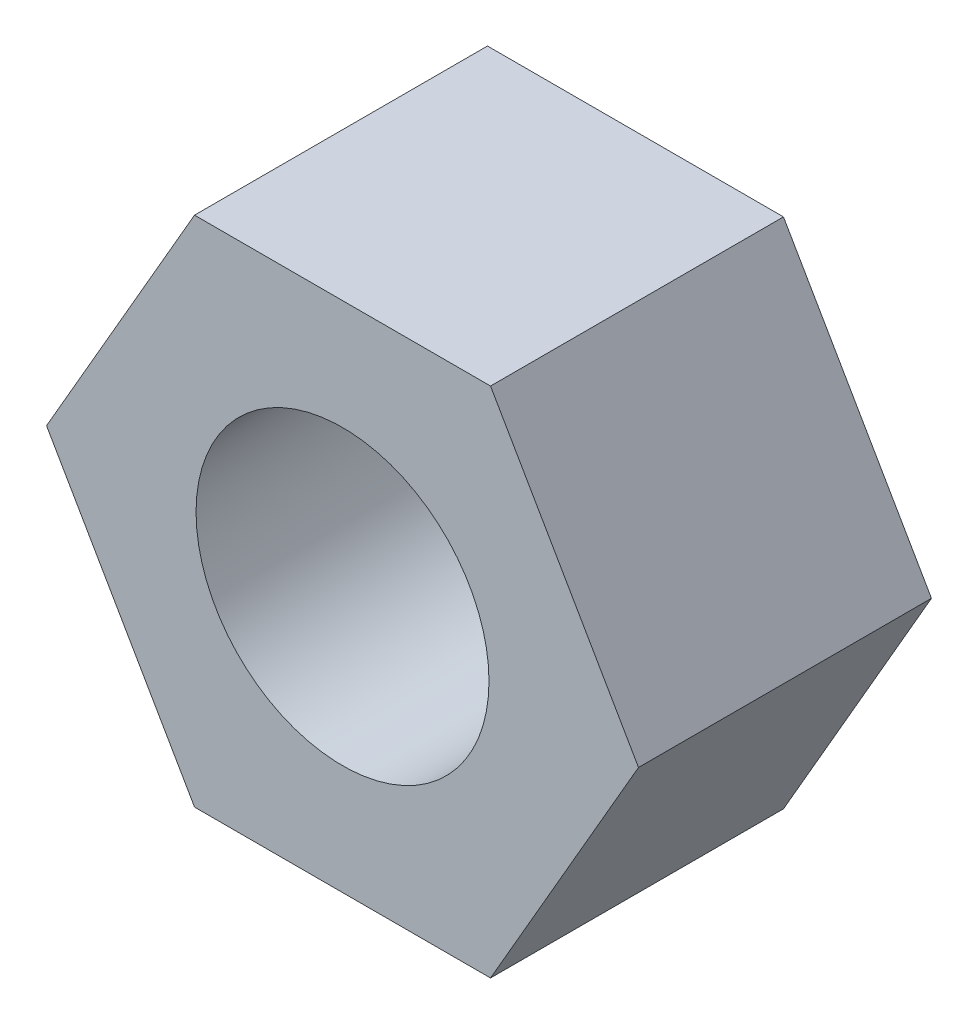
from build123d import *

# Parameters (mm, degrees)
SKETCH1_R           = 6.35
BOSS_EXTRUDE1_DEPTH = 12.7


with BuildPart() as part:
    # Sketch1 → Boss-Extrude1 (new body)
    with BuildSketch(Plane.XY):
        Polygon((6.415804866, -11.1125), (12.831609733, 0), (6.415804866, 11.1125), (-6.415804866, 11.1125), (-12.831609733, 0), (-6.415804866, -11.1125), align=None)
        Circle(SKETCH1_R, mode=Mode.SUBTRACT)
    extrude(amount=BOSS_EXTRUDE1_DEPTH)


solid = part.part
